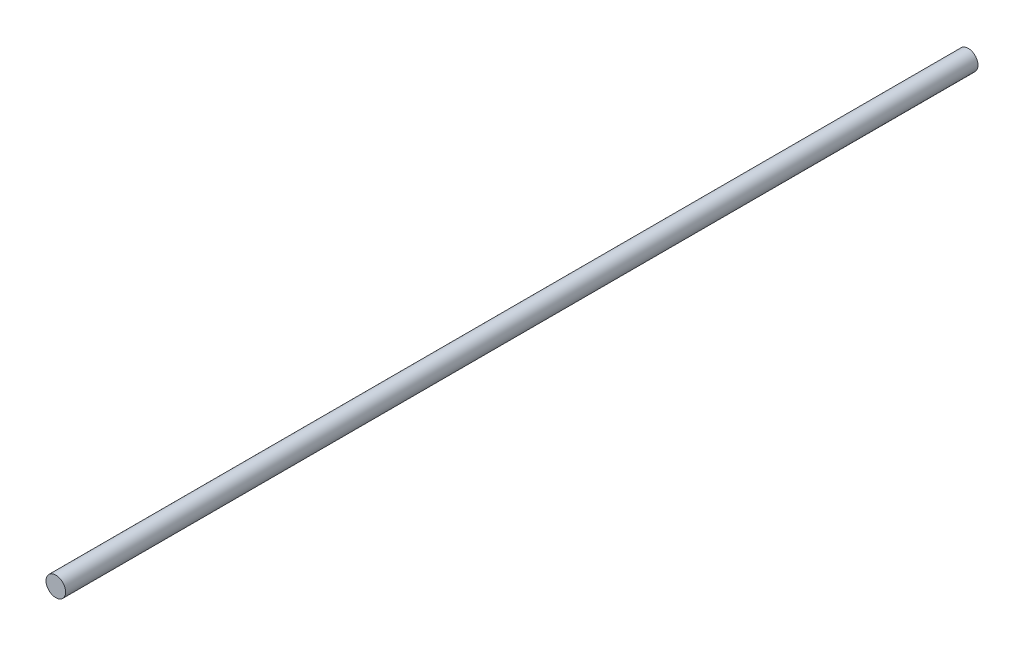
from build123d import *

# Parameters (mm, degrees)
ESBO_O1_R                = 4
RESSALTO_EXTRUS_O1_DEPTH = 372


with BuildPart() as part:
    # Esboço1 → Ressalto-extrusão1 (new body)
    with BuildSketch(Plane.XY):
        with Locations(Location((0, 0, 0), (0, 0, 180))):
            Circle(ESBO_O1_R)
    extrude(amount=RESSALTO_EXTRUS_O1_DEPTH)


solid = part.part
